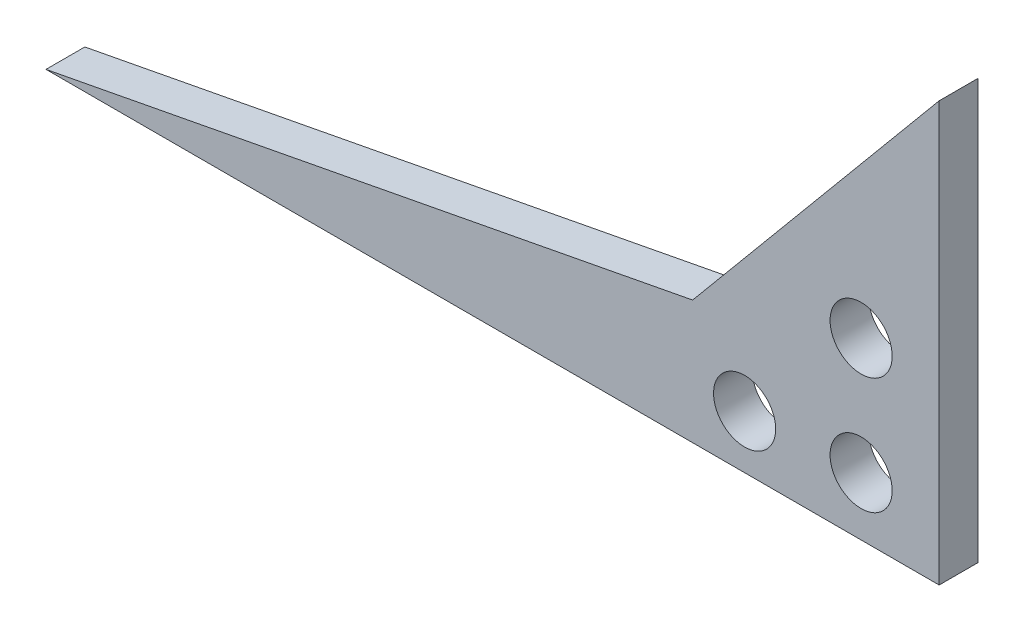
from build123d import *

# Parameters (mm, degrees)
BOSS_EXTRUDE1_DEPTH = 5
SKETCH2_R           = 4
CUT_EXTRUDE1_DEPTH  = 5


with BuildPart() as part:
    # Sketch1 → Boss-Extrude1 (new body)
    with BuildSketch(Plane.XY):
        Polygon((-27.36941191, 43.029850731), (-27.36941191, -10.970149254), (-72.36941191, -10.970149254), (-142.36941191, -10.970149254), (-59.112279179, 4.938410019), align=None)
    extrude(amount=BOSS_EXTRUDE1_DEPTH)

    # Sketch2 → Cut-Extrude1 (cut)
    with BuildSketch(Plane.XY.offset(5)):
        with Locations((-37.419438967, -3.470149254)):
            Circle(SKETCH2_R)
        with Locations((-37.419438967, 11.529850746)):
            Circle(SKETCH2_R)
        with Locations((-52.419438967, -4.105668706)):
            Circle(SKETCH2_R)
    extrude(amount=-CUT_EXTRUDE1_DEPTH, mode=Mode.SUBTRACT)


solid = part.part
